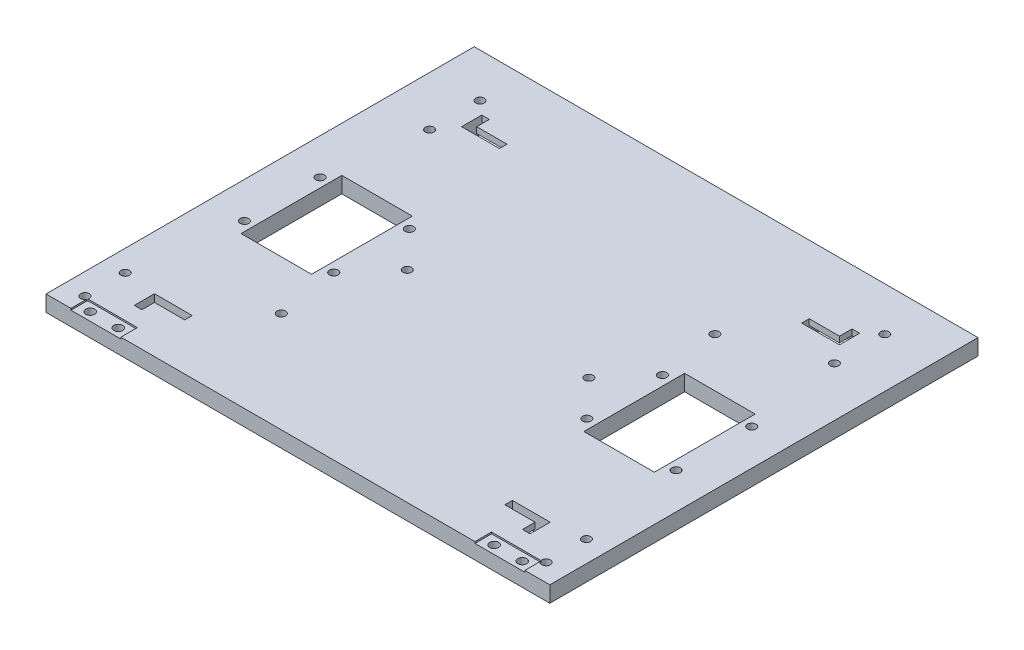
from build123d import *

# Parameters (mm, degrees)
SKETCH1_W                                       = 200
SKETCH1_H                                       = 170
F_1_4_STEEL_PLATE_DEPTH                         = 6.35
SKETCH2_W                                       = 19.812
SKETCH2_H                                       = 6.604
BLADEHINGECUT_DEPTH                             = 0.635
BLADEHINGEHOLE_D                                = 3.556
SKETCH5_W                                       = 5.05
SKETCH5_H                                       = 5.05
BLADENUTCUT_DEPTH                               = 2
SKETCH6_W                                       = 28
SKETCH6_H                                       = 40
CUT_EXTRUDE1_DEPTH                              = 6.35
SKETCH7_W                                       = 30
SKETCH7_H                                       = 10
SKETCH7_W_2                                     = 10
SKETCH7_H_2                                     = 40
SKETCH7_H_3                                     = 30
SKETCH7_W_3                                     = 40
CUT_EXTRUDE2_DEPTH                              = 5
CUT_EXTRUDE3_START                              = -6.35
SKETCH8_W                                       = 15
SKETCH8_H                                       = 10
CUT_EXTRUDE3_DEPTH                              = 4
CUT_EXTRUDE4_DEPTH                              = 2.35
SKETCH10_W                                      = 15
SKETCH10_H                                      = 10
CUT_EXTRUDE5_DEPTH                              = 4
CUT_EXTRUDE6_REACH                              = 133.305
CSK_FOR_M3_FLAT_HEAD_MACHINE_SCREW1_D           = 3.4
CSK_FOR_M3_FLAT_HEAD_MACHINE_SCREW1_DEPTH       = 14
CSK_FOR_M3_FLAT_HEAD_MACHINE_SCREW1_CSINK_D     = 6.3
CSK_FOR_M3_FLAT_HEAD_MACHINE_SCREW1_CSINK_ANGLE = 90


with BuildPart() as part:
    # Sketch1 → 1/4" Steel Plate (new body)
    with BuildSketch(Plane(origin=(0, 0, 0), x_dir=(1, 0, 0), z_dir=(0, 1, 0))):
        Rectangle(SKETCH1_W, SKETCH1_H)
    extrude(amount=F_1_4_STEEL_PLATE_DEPTH)

    # Sketch2 → BladeHingeCut (cut)
    with BuildSketch(Plane(origin=(0, 6.35, 0), x_dir=(1, 0, 0), z_dir=(0, 1, 0))):
        with Locations((-80.188, -81.698)):
            Rectangle(SKETCH2_W, SKETCH2_H)
    bladehingecut = extrude(amount=-BLADEHINGECUT_DEPTH, mode=Mode.SUBTRACT)

    # BladeHingeHole (through all)
    with Locations(Plane(origin=(-74.6, 5.715, 81.698), x_dir=(0, 0, 1), z_dir=(0, 1, 0))):
        with Locations((0, 0), (0, -11.176)):
            bladehingehole = Hole(BLADEHINGEHOLE_D / 2)

    # Sketch5 → BladeNutCut (cut)
    with BuildSketch(Plane.XZ):
        with Locations((-85.776, 81.698)):
            Rectangle(SKETCH5_W, SKETCH5_H)
        with Locations((-74.6, 81.698)):
            Rectangle(SKETCH5_W, SKETCH5_H)
    bladenutcut = extrude(amount=-BLADENUTCUT_DEPTH, mode=Mode.SUBTRACT)

    # BladeHingeMirror: BladeHingeCut, BladeHingeHole, BladeNutCut across plane
    add(bladehingecut.mirror(Plane.ZY), mode=Mode.SUBTRACT)
    add(bladehingehole.mirror(Plane.ZY), mode=Mode.SUBTRACT)
    add(bladenutcut.mirror(Plane.ZY), mode=Mode.SUBTRACT)

    # Sketch6 → Cut-Extrude1 (cut)
    with BuildSketch(Plane(origin=(0, 0, 0), x_dir=(-1, 0, 0), z_dir=(0, -1, 0))):
        with Locations((68.050545531, -5.523276363)):
            Rectangle(SKETCH6_W, SKETCH6_H)
    cut_extrude1 = extrude(amount=-CUT_EXTRUDE1_DEPTH, mode=Mode.SUBTRACT)

    # Sketch7 → Cut-Extrude2 (cut)
    with BuildSketch(Plane(origin=(0, 0, 0), x_dir=(-1, 0, 0), z_dir=(0, -1, 0))):
        with Locations((68.050545531, -35.523276363)):
            Rectangle(SKETCH7_W, SKETCH7_H)
        with Locations((68.050545531, 24.476723637)):
            Rectangle(SKETCH7_W, SKETCH7_H)
        with Locations((27.050545531, -5.523276363)):
            Rectangle(SKETCH7_W_2, SKETCH7_H_2)
        with Locations((0, -25.523276363)):
            Rectangle(SKETCH7_W, SKETCH7_H)
        with Locations((0, -5.523276363)):
            Rectangle(SKETCH7_W, SKETCH7_H)
        with Locations((0, 14.476723637)):
            Rectangle(SKETCH7_W, SKETCH7_H)
        with Locations((44.050545531, -65.523276363)):
            Rectangle(SKETCH7_W_2, SKETCH7_H_3)
        with Locations((0, -65.523276363)):
            Rectangle(SKETCH7_W_3, SKETCH7_H)
        with Locations((44.050545531, 54.476723637)):
            Rectangle(SKETCH7_W_2, SKETCH7_H_3)
        with Locations((0, 54.476723637)):
            Rectangle(SKETCH7_W_3, SKETCH7_H)
    cut_extrude2 = extrude(amount=-CUT_EXTRUDE2_DEPTH, mode=Mode.SUBTRACT)

    # Sketch8 → Cut-Extrude3 (cut)
    with BuildSketch(Plane(origin=(0, 6.35, 0), x_dir=(1, 0, 0), z_dir=(0, 1, 0)).offset(CUT_EXTRUDE3_START)):
        with Locations((-71.045889297, -68.396)):
            Rectangle(SKETCH8_W, SKETCH8_H)
    cut_extrude3 = extrude(amount=CUT_EXTRUDE3_DEPTH, mode=Mode.SUBTRACT)

    # Sketch9 → Cut-Extrude4 (cut)
    with BuildSketch(Plane.XZ.offset(-4)):
        Polygon((-78.545889297, 63.396), (-63.545889297, 63.396), (-63.545889297, 66.396), (-75.545889297, 66.396), (-75.545889297, 71.396), (-78.545889297, 71.396), align=None)
    cut_extrude4 = extrude(amount=-CUT_EXTRUDE4_DEPTH, mode=Mode.SUBTRACT)

    # Sketch10 → Cut-Extrude5 (cut)
    with BuildSketch(Plane(origin=(0, 0, 0), x_dir=(-1, 0, 0), z_dir=(0, -1, 0))):
        with Locations((67.5, 60)):
            Rectangle(SKETCH10_W, SKETCH10_H)
    cut_extrude5 = extrude(amount=-CUT_EXTRUDE5_DEPTH, mode=Mode.SUBTRACT)

    # Sketch11 → Cut-Extrude6 (cut, up to next)
    with BuildSketch(Plane.XZ.offset(-4), mode=Mode.PRIVATE) as cut_extrude6_sk1:
        Polygon((-60, -55), (-75, -55), (-75, -63), (-72, -63), (-72, -58), (-60, -58), align=None)
    cut_extrude6_tool1 = extrude(cut_extrude6_sk1.sketch, amount=-CUT_EXTRUDE6_REACH, mode=Mode.PRIVATE) & part.part
    cut_extrude6 = cut_extrude6_tool1.solids().sort_by_distance((-69, 4, -57.5))[0]
    add(cut_extrude6, mode=Mode.SUBTRACT)

    # Mirror2: Cut-Extrude1, Cut-Extrude2, Cut-Extrude3, Cut-Extrude4, Cut-Extrude5, Cut-Extrude6 across plane
    add(cut_extrude1.mirror(Plane.ZY), mode=Mode.SUBTRACT)
    add(cut_extrude2.mirror(Plane.ZY), mode=Mode.SUBTRACT)
    add(cut_extrude3.mirror(Plane.ZY), mode=Mode.SUBTRACT)
    add(cut_extrude4.mirror(Plane.ZY), mode=Mode.SUBTRACT)
    add(cut_extrude5.mirror(Plane.ZY), mode=Mode.SUBTRACT)
    add(cut_extrude6.mirror(Plane.ZY), mode=Mode.SUBTRACT)

    # CSK for M3 Flat Head Machine Screw1
    with Locations(Plane(origin=(0, 0, 0), x_dir=(-1, 0, 0), z_dir=(0, -1, 0))):
        with Locations((-91.550289297, -78), (-91.550289297, -62), (-80.337059977, 47.6378), (-80.337059977, 67.6378), (-36.575545542, -6.046552726), (-46.575545542, 33.953447274), (36.575545531, -5), (46.575545531, -45), (91.545889297, -62), (91.545889297, -78), (80.337059966, 47.6378), (80.337059966, 67.6378), (-85.690545542, -20.523276363), (-85.690545542, 9.476723637), (-50.235545542, -20.523276363), (-50.235545542, 9.476723637), (50.235545531, -20.523276363), (85.690545531, -20.523276363), (85.690545531, 9.476723637), (50.235545531, 9.476723637)):
            CounterSinkHole(CSK_FOR_M3_FLAT_HEAD_MACHINE_SCREW1_D / 2, CSK_FOR_M3_FLAT_HEAD_MACHINE_SCREW1_CSINK_D / 2, depth=CSK_FOR_M3_FLAT_HEAD_MACHINE_SCREW1_DEPTH, counter_sink_angle=CSK_FOR_M3_FLAT_HEAD_MACHINE_SCREW1_CSINK_ANGLE)


solid = part.part
